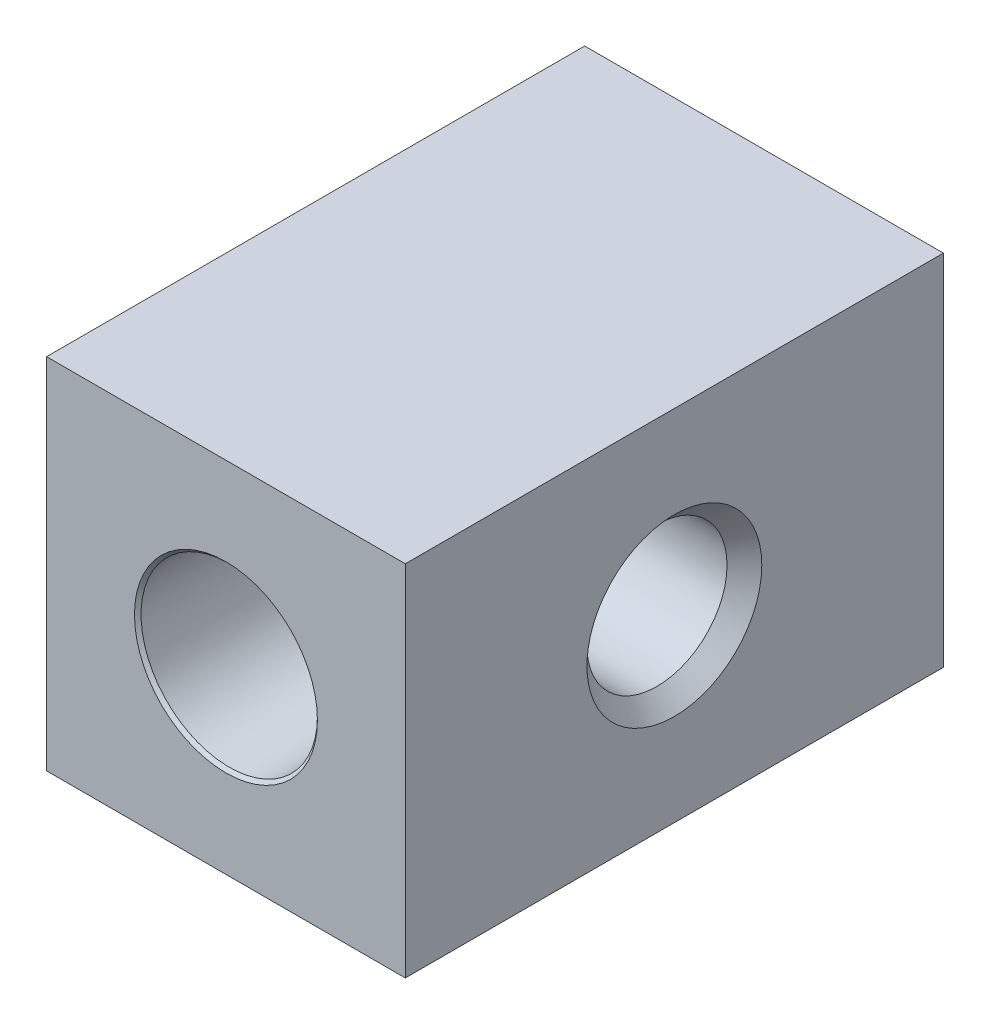
from build123d import *

# Parameters (mm, degrees)
SKETCH2_W                          = 25.4
SKETCH2_H                          = 25.4
BOSS_EXTRUDE1_DEPTH                = 38.1
F_7_16_20_TAPPED_HOLE2_D           = 9.92124
F_7_16_20_TAPPED_HOLE2_DEPTH       = 12.7
F_7_16_20_TAPPED_HOLE2_CSINK_D     = 12.3825
F_7_16_20_TAPPED_HOLE2_CSINK_ANGLE = 90
F_7_16_20_TAPPED_HOLE2_TIP         = 2.980641204


with BuildPart() as part:
    # Sketch2 → Boss-Extrude1 (new body)
    with BuildSketch(Plane.XY):
        Rectangle(SKETCH2_W, SKETCH2_H)
    extrude(amount=BOSS_EXTRUDE1_DEPTH)

    # Sketch6 → 1/4 NPT Tapped Hole1 (revolve, cut)
    with BuildSketch(Plane(origin=(0, 0, 38.1), x_dir=(0, -1, 0), z_dir=(1, 0, 0))):
        Polygon((0, 0), (0, 38.1), (5.5626, 38.1), (5.5626, 10.02), (5.950661746, 10.02), (6.2436883, 0.2333117), (6.477, 0), align=None)
    revolve(axis=Axis((0, 0, 44.45), (0, 0, -1)), mode=Mode.SUBTRACT)

    # Sketch8 → 1/4 NPT Tapped Hole2 (revolve, cut)
    with BuildSketch(Plane.YZ):
        Polygon((0, 0), (0, 38.1), (5.5626, 38.1), (5.5626, 10.02), (5.950661746, 10.02), (6.2436883, 0.2333117), (6.477, 0), align=None)
    revolve(axis=Axis((0, 0, -6.35), (0, 0, 1)), mode=Mode.SUBTRACT)

    # 7/16-20 Tapped Hole2
    with Locations(Plane(origin=(12.7, 0, 0), x_dir=(0, 0, -1), z_dir=(1, 0, 0))):
        with Locations((-19.05, 0)):
            CounterSinkHole(F_7_16_20_TAPPED_HOLE2_D / 2, F_7_16_20_TAPPED_HOLE2_CSINK_D / 2, depth=F_7_16_20_TAPPED_HOLE2_DEPTH, counter_sink_angle=F_7_16_20_TAPPED_HOLE2_CSINK_ANGLE)
            with Locations((0, 0, -(F_7_16_20_TAPPED_HOLE2_DEPTH + F_7_16_20_TAPPED_HOLE2_TIP / 2))):  # 118° drill point
                Cone(0, F_7_16_20_TAPPED_HOLE2_D / 2, F_7_16_20_TAPPED_HOLE2_TIP, mode=Mode.SUBTRACT)


solid = part.part
